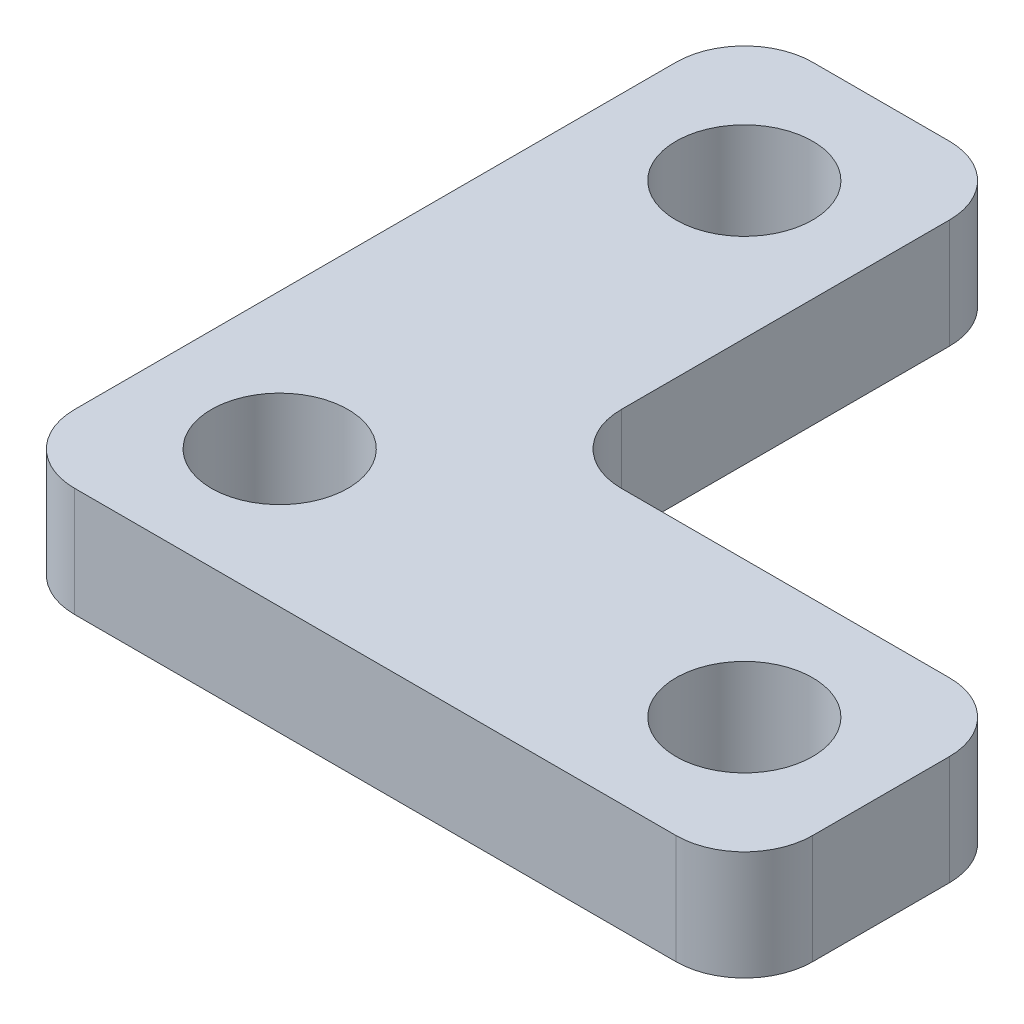
from build123d import *

# Parameters (mm, degrees)
SKETCH1_R           = 2.5
BOSS_EXTRUDE1_DEPTH = 4


with BuildPart() as part:
    # Sketch1 → Boss-Extrude1 (new body)
    with BuildSketch(Plane(origin=(0, 0, 0), x_dir=(1, 0, 0), z_dir=(0, 1, 0))):
        with BuildLine():
            Line((0, 2.5), (0, 24.5))
            ThreePointArc((0, 24.5), (0.732233047, 26.267766953), (2.5, 27))
            Line((2.5, 27), (7.5, 27))
            ThreePointArc((7.5, 27), (9.267766953, 26.267766953), (10, 24.5))
            Line((10, 24.5), (10, 12.5))
            ThreePointArc((10, 12.5), (10.732233047, 10.732233047), (12.5, 10))
            Line((12.5, 10), (24.5, 10))
            ThreePointArc((24.5, 10), (26.267766953, 9.267766953), (27, 7.5))
            Line((27, 7.5), (27, 2.5))
            ThreePointArc((27, 2.5), (26.267766953, 0.732233047), (24.5, 0))
            Line((24.5, 0), (2.5, 0))
            ThreePointArc((2.5, 0), (0.732233047, 0.732233047), (0, 2.5))
        make_face()
        with Locations(Location((22, 5, 0), (0, 0, 270))):
            Circle(SKETCH1_R, mode=Mode.SUBTRACT)
        with Locations(Location((5, 5, 0), (0, 0, 270))):
            Circle(SKETCH1_R, mode=Mode.SUBTRACT)
        with Locations(Location((5, 22, 0), (0, 0, 270))):
            Circle(SKETCH1_R, mode=Mode.SUBTRACT)
    extrude(amount=BOSS_EXTRUDE1_DEPTH)


solid = part.part
